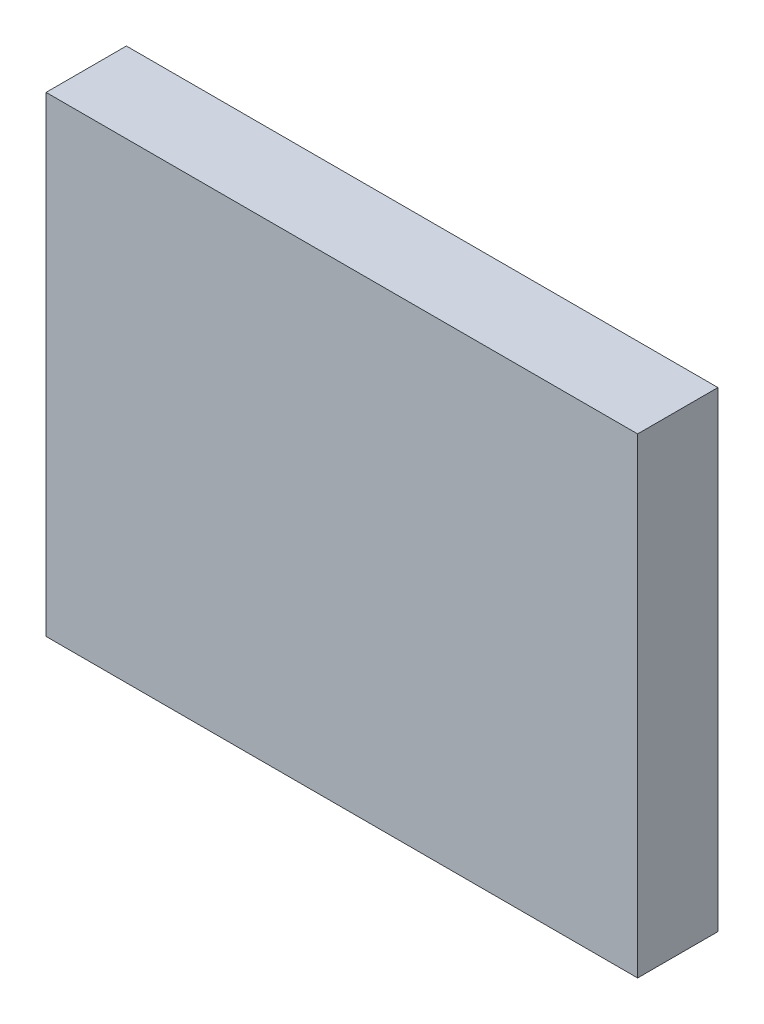
from build123d import *

# Parameters (mm, degrees)
SKETCH1_W           = 73.66
SKETCH1_H           = 58.674
BOSS_EXTRUDE1_DEPTH = 10


with BuildPart() as part:
    # Sketch1 → Boss-Extrude1 (new body)
    with BuildSketch(Plane.XY):
        with Locations((36.83, 29.337)):
            Rectangle(SKETCH1_W, SKETCH1_H)
    extrude(amount=BOSS_EXTRUDE1_DEPTH)


solid = part.part
